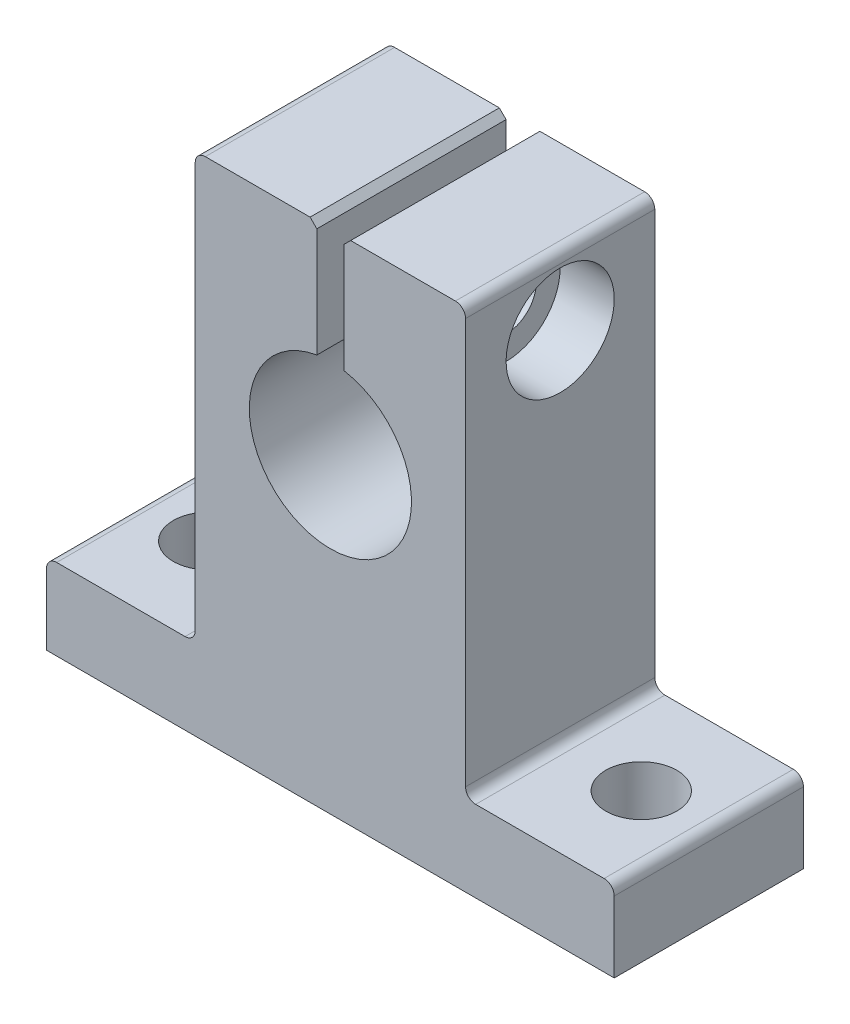
from build123d import *

# Parameters (mm, degrees)
SALIENTE_EXTRUIR1_DEPTH = 14
CROQUIS16_W             = 1.65
CROQUIS16_H             = 20
CORTAR_EXTRUIR3_REACH   = 42.364
CROQUIS4_R              = 2.625
REDONDEO0_75MM_R        = 0.75
CHAFL_N0_5MM_SIZE       = 0.5
CORTAR_EXTRUIR5_REACH   = 52.629
CROQUIS24_R             = 2.25
CROQUIS23_R             = 4
CORTAR_EXTRUIR4_DEPTH   = 4


with BuildPart() as part:
    # Croquis1 → Saliente-Extruir1 (new body)
    with BuildSketch(Plane.XY):
        with BuildLine():
            Line((0, 17), (0, 0))
            Line((0, 0), (21, 0))
            Line((21, 0), (21, 6))
            Line((21, 6), (10, 6))
            Line((10, 6), (10, 37.5))
            Line((10, 37.5), (1, 37.5))
            Line((1, 37.5), (1, 28.916079783))
            ThreePointArc((1, 28.916079783), (5.978983137, 22.498242438), (0, 17))
        make_face()
        with BuildLine():
            Line((-21, 6), (-21, 0))
            Line((-21, 0), (0, 0))
            Line((0, 0), (0, 17))
            ThreePointArc((0, 17), (-5.978983137, 22.498242438), (-1, 28.916079783))
            Line((-1, 28.916079783), (-1, 37.5))
            Line((-1, 37.5), (-10, 37.5))
            Line((-10, 37.5), (-10, 6))
            Line((-10, 6), (-21, 6))
        make_face()
    extrude(amount=SALIENTE_EXTRUIR1_DEPTH)

    # Croquis16 → Taladro roscado M43 (revolve, cut)
    with BuildSketch(Plane(origin=(-1, 32.5, 7), x_dir=(0, 0, -1), z_dir=(0, 1, 0))):
        with Locations((0.825, 10)):
            Rectangle(CROQUIS16_W, CROQUIS16_H)
    revolve(axis=Axis((5.35, 32.5, 7), (-1, 0, 0)), mode=Mode.SUBTRACT)

    # Croquis4 → Cortar-Extruir3 (cut, up to next)
    with BuildSketch(Plane(origin=(0, 6, 0), x_dir=(1, 0, 0), z_dir=(0, 1, 0)), mode=Mode.PRIVATE) as cortar_extruir3_sk1:
        with Locations(Location((-16, -7, 0), (0, 0, 180))):
            Circle(CROQUIS4_R)
    cortar_extruir3_tool1 = extrude(cortar_extruir3_sk1.sketch, amount=-CORTAR_EXTRUIR3_REACH, mode=Mode.PRIVATE) & part.part
    # Croquis4 → Cortar-Extruir3 (cut, up to next)
    with BuildSketch(Plane(origin=(0, 6, 0), x_dir=(1, 0, 0), z_dir=(0, 1, 0)), mode=Mode.PRIVATE) as cortar_extruir3_sk2:
        with Locations(Location((16, -7, 0), (0, 0, 180))):
            Circle(CROQUIS4_R)
    cortar_extruir3_tool2 = extrude(cortar_extruir3_sk2.sketch, amount=-CORTAR_EXTRUIR3_REACH, mode=Mode.PRIVATE) & part.part
    add(cortar_extruir3_tool1.solids().sort_by_distance((-16, 6, 7))[0], mode=Mode.SUBTRACT)
    add(cortar_extruir3_tool2.solids().sort_by_distance((16, 6, 7))[0], mode=Mode.SUBTRACT)

    # Redondeo0,75mm
    redondeo0_75mm_edges = [part.edges().sort_by_distance(p)[0] for p in [
        (10, 37.5, 7),
        (10, 6, 7),
        (21, 6, 7),
        (-21, 6, 7),
        (-10, 6, 7),
        (-10, 37.5, 7),
    ]]
    fillet(redondeo0_75mm_edges, radius=REDONDEO0_75MM_R)

    # Chaflán0,5mm
    chafl_n0_5mm_edges = [part.edges().sort_by_distance(p)[0] for p in [
        (1, 37.5, 7),
        (-1, 37.5, 7),
    ]]
    chamfer(chafl_n0_5mm_edges, length=CHAFL_N0_5MM_SIZE)

    # Croquis24 → Cortar-Extruir5 (cut, up to next)
    with BuildSketch(Plane(origin=(10, 0, 0), x_dir=(0, 0, -1), z_dir=(1, 0, 0)), mode=Mode.PRIVATE) as cortar_extruir5_sk1:
        with Locations(Location((-7, 32.5, 0), (0, 0, 90))):
            Circle(CROQUIS24_R)
    cortar_extruir5_tool1 = extrude(cortar_extruir5_sk1.sketch, amount=-CORTAR_EXTRUIR5_REACH, mode=Mode.PRIVATE) & part.part
    add(cortar_extruir5_tool1.solids().sort_by_distance((10, 32.5, 7))[0], mode=Mode.SUBTRACT)

    # Croquis23 → Cortar-Extruir4 (cut)
    with BuildSketch(Plane.ZY.offset(-10)):
        with Locations(Location((7, 32.5, 0), (0, 0, 270))):
            Circle(CROQUIS23_R)
    extrude(amount=CORTAR_EXTRUIR4_DEPTH, mode=Mode.SUBTRACT)


solid = part.part
